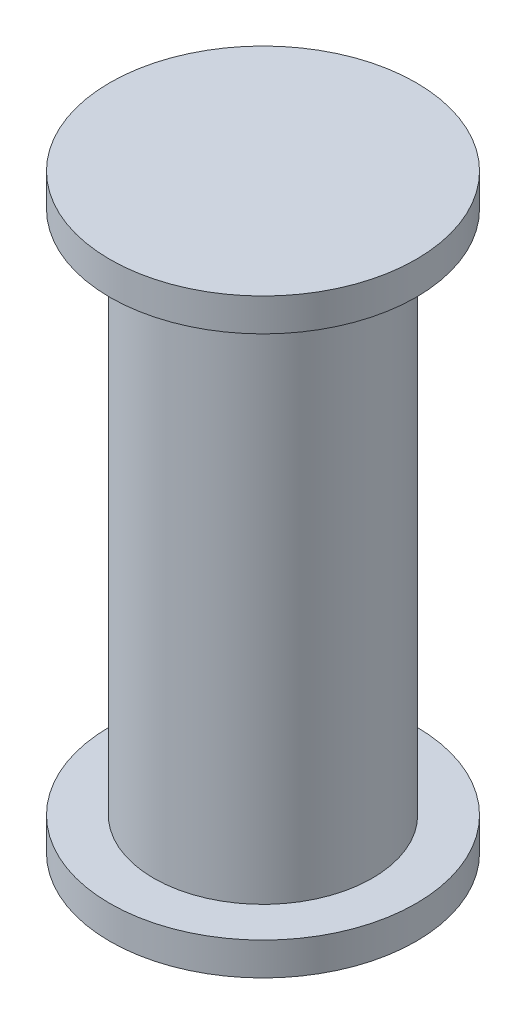
from build123d import *

# Parameters (mm, degrees)
SKETCH1_R           = 5
BOSS_EXTRUDE1_DEPTH = 12
SKETCH2_R           = 7
BOSS_EXTRUDE2_DEPTH = 1.5


with BuildPart() as part:
    # Sketch1 → Boss-Extrude1 (new, symmetric)
    with BuildSketch(Plane(origin=(0, 0, 0), x_dir=(1, 0, 0), z_dir=(0, 1, 0))):
        with Locations(Location((0, 0, 0), (0, 0, 270))):
            Circle(SKETCH1_R)
    extrude(amount=BOSS_EXTRUDE1_DEPTH, both=True)

    # Sketch2 → Boss-Extrude2 (add)
    with BuildSketch(Plane(origin=(0, 12, 0), x_dir=(1, 0, 0), z_dir=(0, 1, 0))):
        with Locations(Location((0, 0, 0), (0, 0, 270))):
            Circle(SKETCH2_R)
    boss_extrude2 = extrude(amount=BOSS_EXTRUDE2_DEPTH)

    # Mirror1: Boss-Extrude2 across plane
    add(boss_extrude2.mirror(Plane.ZX))


solid = part.part
